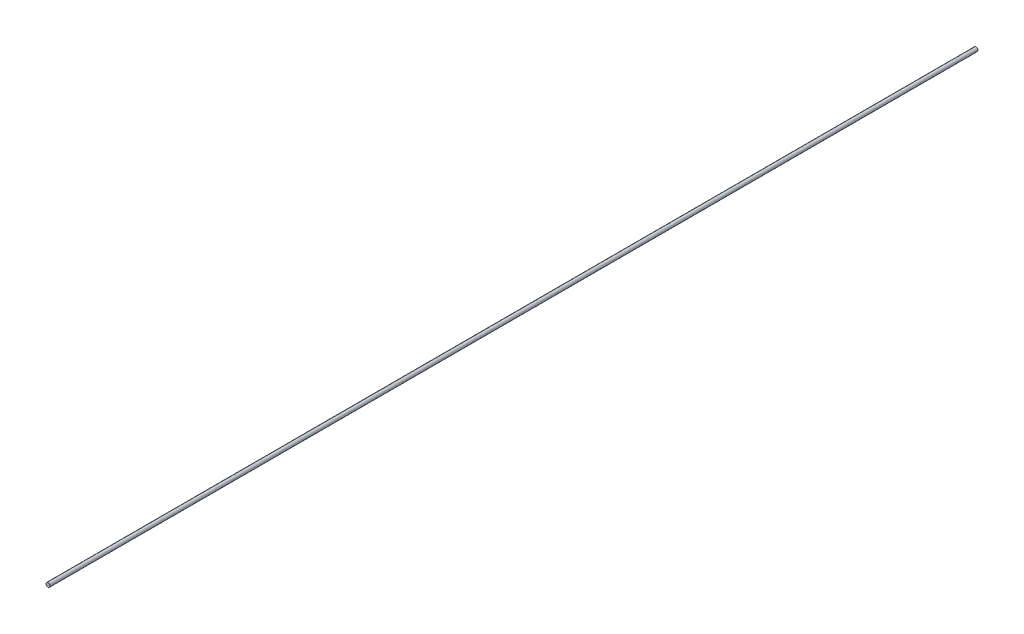
from build123d import *

# Parameters (mm, degrees)
SKETCH_1_R      = 1
EXTRUDE_1_DEPTH = 465


with BuildPart() as part:
    # Эскиз1 → Бобышка-Вытянуть1 (new body)
    with BuildSketch(Plane.XY):
        Circle(SKETCH_1_R)
    extrude(amount=EXTRUDE_1_DEPTH)


solid = part.part
